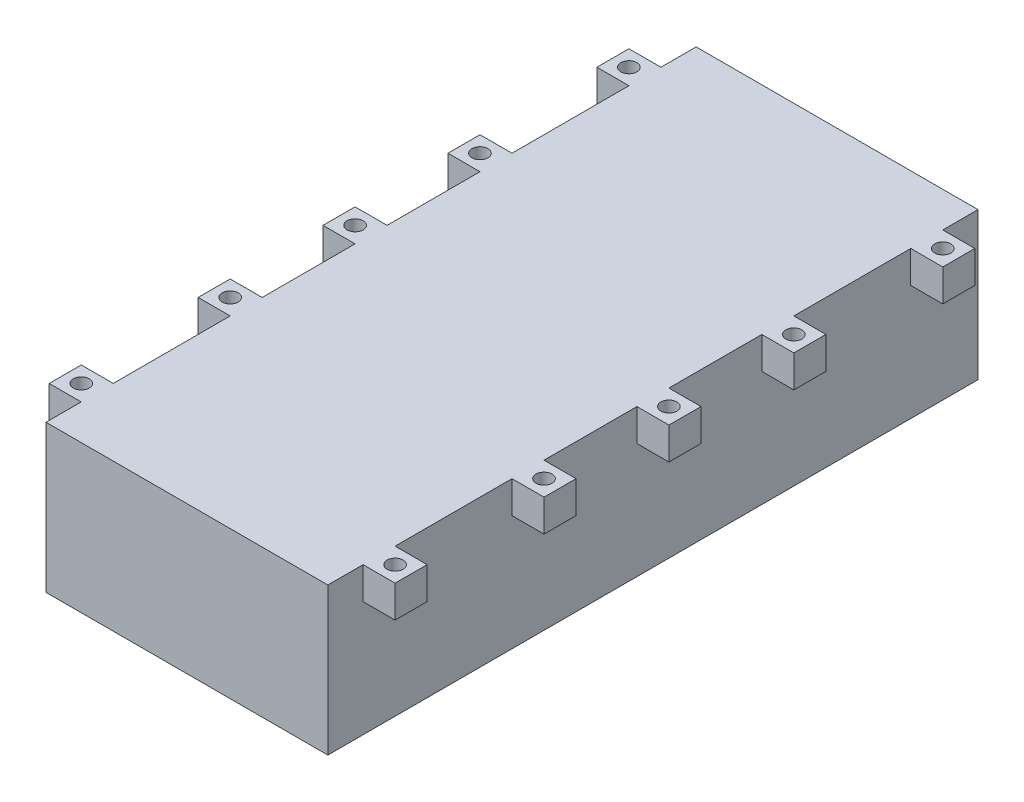
from build123d import *

# Parameters (mm, degrees)
SKETCH1_W           = 88
SKETCH1_H           = 46
SKETCH1_W_2         = 82
SKETCH1_H_2         = 40
BOSS_EXTRUDE1_DEPTH = 3
SKETCH3_W           = 88
SKETCH3_H           = 46
BOSS_EXTRUDE2_DEPTH = 200
SKETCH6_W           = 10
SKETCH6_H           = 10
SKETCH6_R           = 2.5
BOSS_EXTRUDE4_DEPTH = 10


with BuildPart() as part:
    # Sketch1 → Boss-Extrude1 (new body)
    # profile 1 of 2: a face of its own
    with BuildSketch(Plane.XY):
        with Locations((-44, -23)):
            Rectangle(SKETCH1_W, SKETCH1_H)
        with Locations((-44, -23)):
            Rectangle(SKETCH1_W_2, SKETCH1_H_2, mode=Mode.SUBTRACT)
    # profile 2 of 2: a face of its own
    with BuildSketch(Plane.XY):
        with Locations((-44, -23)):
            Rectangle(SKETCH1_W_2, SKETCH1_H_2)
    extrude(amount=BOSS_EXTRUDE1_DEPTH)

    # Sketch3 → Boss-Extrude2 (add)
    with BuildSketch(Plane(origin=(0, 0, 0), x_dir=(-1, 0, 0), z_dir=(0, 0, -1))):
        with Locations((44, -23)):
            Rectangle(SKETCH3_W, SKETCH3_H)
        Polygon((24, -3), (43, -3), (43, -1.5), (45, -1.5), (45, -3), (64, -3), (64, -1.5), (66, -1.5), (66, -3), (85, -3), (85, -43), (66, -43), (66, -44.5), (64, -44.5), (64, -43), (45, -43), (45, -44.5), (43, -44.5), (43, -43), (24, -43), (24, -44.5), (22, -44.5), (22, -43), (3, -43), (3, -3), (22, -3), (22, -1.5), (24, -1.5), align=None, mode=Mode.SUBTRACT)
    extrude(amount=BOSS_EXTRUDE2_DEPTH)

    # Sketch6 → Boss-Extrude4 (add)
    # profile 1 of 10: a face of its own
    with BuildSketch(Plane(origin=(0, 0, 0), x_dir=(1, 0, 0), z_dir=(0, 1, 0))):
        with Locations((-93, 98.5)):
            Rectangle(SKETCH6_W, SKETCH6_H)
        with Locations(Location((-93, 98.5, 0), (0, 0, 270))):
            Circle(SKETCH6_R, mode=Mode.SUBTRACT)
    # profile 2 of 10: a face of its own
    with BuildSketch(Plane(origin=(0, 0, 0), x_dir=(1, 0, 0), z_dir=(0, 1, 0))):
        with Locations((5, 98.5)):
            Rectangle(SKETCH6_W, SKETCH6_H)
        with Locations(Location((5, 98.5, 0), (0, 0, 270))):
            Circle(SKETCH6_R, mode=Mode.SUBTRACT)
    # profile 3 of 10: a face of its own
    with BuildSketch(Plane(origin=(0, 0, 0), x_dir=(1, 0, 0), z_dir=(0, 1, 0))):
        with Locations((-93, 137.5)):
            Rectangle(SKETCH6_W, SKETCH6_H)
        with Locations(Location((-93, 137.5, 0), (0, 0, 270))):
            Circle(SKETCH6_R, mode=Mode.SUBTRACT)
    # profile 4 of 10: a face of its own
    with BuildSketch(Plane(origin=(0, 0, 0), x_dir=(1, 0, 0), z_dir=(0, 1, 0))):
        with Locations((5, 137.5)):
            Rectangle(SKETCH6_W, SKETCH6_H)
        with Locations(Location((5, 137.5, 0), (0, 0, 270))):
            Circle(SKETCH6_R, mode=Mode.SUBTRACT)
    # profile 5 of 10: a face of its own
    with BuildSketch(Plane(origin=(0, 0, 0), x_dir=(1, 0, 0), z_dir=(0, 1, 0))):
        with Locations((-93, 59.5)):
            Rectangle(SKETCH6_W, SKETCH6_H)
        with Locations(Location((-93, 59.5, 0), (0, 0, 270))):
            Circle(SKETCH6_R, mode=Mode.SUBTRACT)
    # profile 6 of 10: a face of its own
    with BuildSketch(Plane(origin=(0, 0, 0), x_dir=(1, 0, 0), z_dir=(0, 1, 0))):
        with Locations((5, 59.5)):
            Rectangle(SKETCH6_W, SKETCH6_H)
        with Locations(Location((5, 59.5, 0), (0, 0, 270))):
            Circle(SKETCH6_R, mode=Mode.SUBTRACT)
    # profile 7 of 10: a face of its own
    with BuildSketch(Plane(origin=(0, 0, 0), x_dir=(1, 0, 0), z_dir=(0, 1, 0))):
        with Locations((-93, 13)):
            Rectangle(SKETCH6_W, SKETCH6_H)
        with Locations(Location((-93, 13, 0), (0, 0, 270))):
            Circle(SKETCH6_R, mode=Mode.SUBTRACT)
    # profile 8 of 10: a face of its own
    with BuildSketch(Plane(origin=(0, 0, 0), x_dir=(1, 0, 0), z_dir=(0, 1, 0))):
        with Locations((5, 13)):
            Rectangle(SKETCH6_W, SKETCH6_H)
        with Locations(Location((5, 13, 0), (0, 0, 270))):
            Circle(SKETCH6_R, mode=Mode.SUBTRACT)
    # profile 9 of 10: a face of its own
    with BuildSketch(Plane(origin=(0, 0, 0), x_dir=(1, 0, 0), z_dir=(0, 1, 0))):
        with Locations((5, 184)):
            Rectangle(SKETCH6_W, SKETCH6_H)
        with Locations(Location((5, 184, 0), (0, 0, 270))):
            Circle(SKETCH6_R, mode=Mode.SUBTRACT)
    # profile 10 of 10: a face of its own
    with BuildSketch(Plane(origin=(0, 0, 0), x_dir=(1, 0, 0), z_dir=(0, 1, 0))):
        with Locations((-93, 184)):
            Rectangle(SKETCH6_W, SKETCH6_H)
        with Locations(Location((-93, 184, 0), (0, 0, 270))):
            Circle(SKETCH6_R, mode=Mode.SUBTRACT)
    extrude(amount=-BOSS_EXTRUDE4_DEPTH)


solid = part.part
